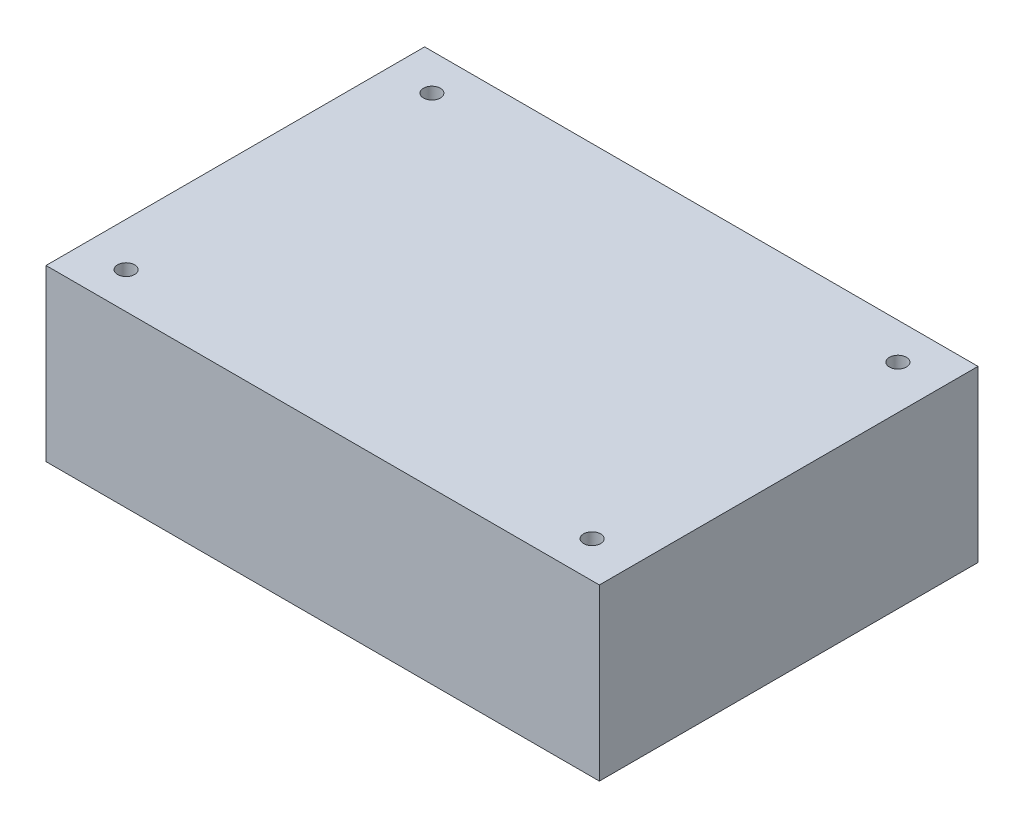
from build123d import *

# Parameters (mm, degrees)
SKETCH_1_W      = 114
SKETCH_1_H      = 78
SKETCH_1_R      = 1.75
EXTRUDE_1_DEPTH = 35


with BuildPart() as part:
    # 草图1 → 凸台-拉伸1 (new body)
    with BuildSketch(Plane(origin=(0, 0, 0), x_dir=(1, 0, 0), z_dir=(0, 1, 0))):
        Rectangle(SKETCH_1_W, SKETCH_1_H)
        with Locations(Location((-48, 31.5, 0), (0, 0, 270))):
            Circle(SKETCH_1_R, mode=Mode.SUBTRACT)
        with Locations(Location((-48, -31.5, 0), (0, 0, 270))):
            Circle(SKETCH_1_R, mode=Mode.SUBTRACT)
        with Locations(Location((48, -31.5, 0), (0, 0, 270))):
            Circle(SKETCH_1_R, mode=Mode.SUBTRACT)
        with Locations(Location((48, 31.5, 0), (0, 0, 270))):
            Circle(SKETCH_1_R, mode=Mode.SUBTRACT)
    extrude(amount=EXTRUDE_1_DEPTH)


solid = part.part
